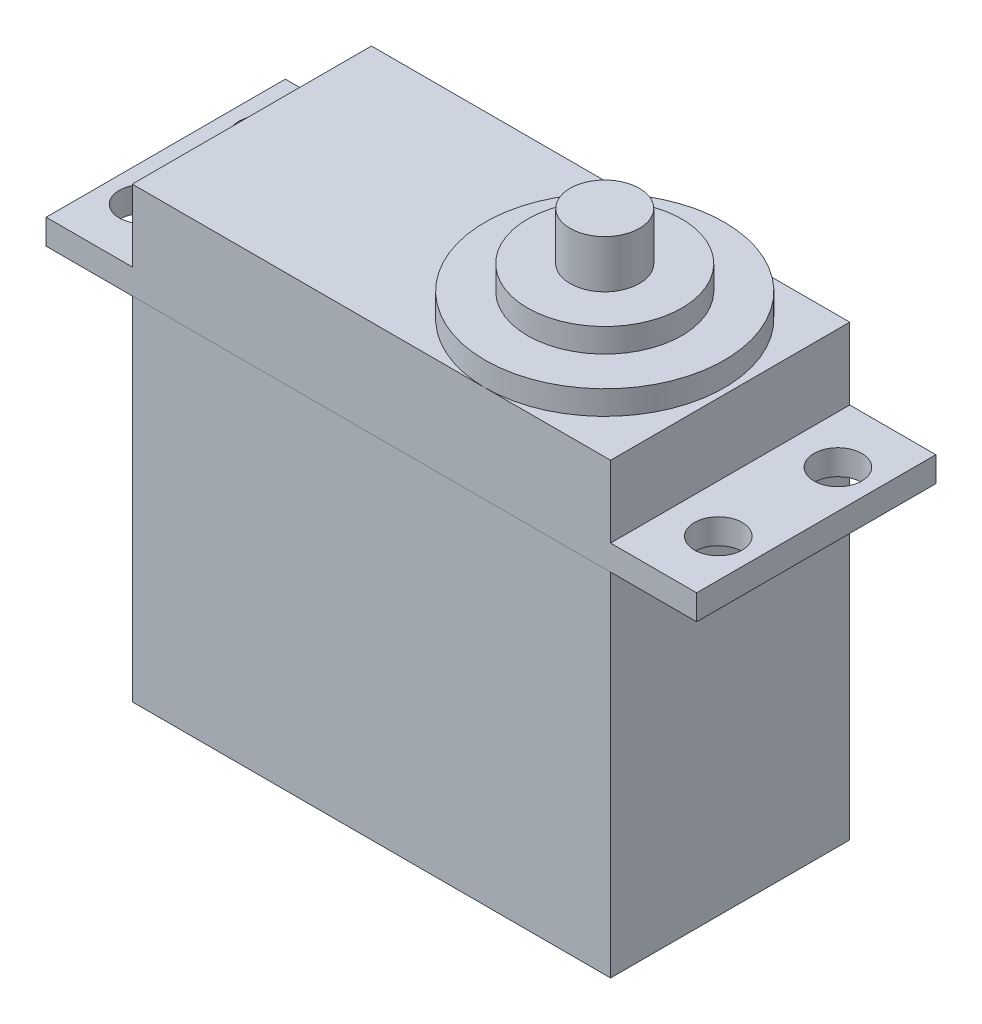
from build123d import *

# Parameters (mm, degrees)
CROQUIS1_W              = 40
CROQUIS1_H              = 20
SALIENTE_EXTRUIR1_DEPTH = 29.4
SALIENTE_EXTRUIR2_DEPTH = 2.1
CROQUIS3_R              = 2
CORTAR_EXTRUIR1_DEPTH   = 2.1
SALIENTE_EXTRUIR3_DEPTH = 6
CROQUIS5_R              = 10.001656383
SALIENTE_EXTRUIR4_DEPTH = 2
CROQUIS6_R              = 6.45
SALIENTE_EXTRUIR5_DEPTH = 2
CROQUIS7_R              = 2.9
SALIENTE_EXTRUIR6_DEPTH = 4


with BuildPart() as part:
    # Croquis1 → Saliente-Extruir1 (new body)
    with BuildSketch(Plane(origin=(0, 0, 0), x_dir=(1, 0, 0), z_dir=(0, 1, 0))):
        with Locations((20, -10)):
            Rectangle(CROQUIS1_W, CROQUIS1_H)
    extrude(amount=SALIENTE_EXTRUIR1_DEPTH)

    # Croquis2 → Saliente-Extruir2 (add)
    with BuildSketch(Plane(origin=(0, 29.4, 0), x_dir=(1, 0, 0), z_dir=(0, 1, 0))):
        Polygon((20, 0), (-7.2, 0), (-7.2, -20.003312767), (47.2, -20.003312767), (47.2, 0), align=None)
    extrude(amount=SALIENTE_EXTRUIR2_DEPTH)

    # Croquis3 → Cortar-Extruir1 (cut)
    with BuildSketch(Plane(origin=(0, 31.5, 0), x_dir=(1, 0, 0), z_dir=(0, 1, 0))):
        with Locations(Location((-4.095776159, -5.000828192, 0), (0, 0, 270))):
            Circle(CROQUIS3_R)
        with Locations(Location((-4.095776159, -15.002484575, 0), (0, 0, 270))):
            Circle(CROQUIS3_R)
        with Locations(Location((44.010481376, -5.000828192, 0), (0, 0, 270))):
            Circle(CROQUIS3_R)
        with Locations(Location((44.010481376, -15.002484575, 0), (0, 0, 270))):
            Circle(CROQUIS3_R)
    extrude(amount=-CORTAR_EXTRUIR1_DEPTH, mode=Mode.SUBTRACT)

    # Croquis4 → Saliente-Extruir3 (add)
    with BuildSketch(Plane(origin=(0, 31.5, 0), x_dir=(1, 0, 0), z_dir=(0, 1, 0))):
        Polygon((0, 0), (0, -20.003312767), (40.001626581, -20.003312767), (40, 0), align=None)
    extrude(amount=SALIENTE_EXTRUIR3_DEPTH)

    # Croquis5 → Saliente-Extruir4 (add)
    with BuildSketch(Plane(origin=(0, 37.5, 0), x_dir=(1, 0, 0), z_dir=(0, 1, 0))):
        with Locations(Location((29.510368289, -10.001656383, 0), (0, 0, 270))):
            Circle(CROQUIS5_R)
    extrude(amount=SALIENTE_EXTRUIR4_DEPTH)

    # Croquis6 → Saliente-Extruir5 (add)
    with BuildSketch(Plane(origin=(0, 39.5, 0), x_dir=(1, 0, 0), z_dir=(0, 1, 0))):
        with Locations(Location((29.510368289, -10.001656383, 0), (0, 0, 270))):
            Circle(CROQUIS6_R)
    extrude(amount=SALIENTE_EXTRUIR5_DEPTH)

    # Croquis7 → Saliente-Extruir6 (add)
    with BuildSketch(Plane(origin=(0, 41.5, 0), x_dir=(1, 0, 0), z_dir=(0, 1, 0))):
        with Locations(Location((29.510368289, -10.001656383, 0), (0, 0, 270))):
            Circle(CROQUIS7_R)
    extrude(amount=SALIENTE_EXTRUIR6_DEPTH)


solid = part.part
